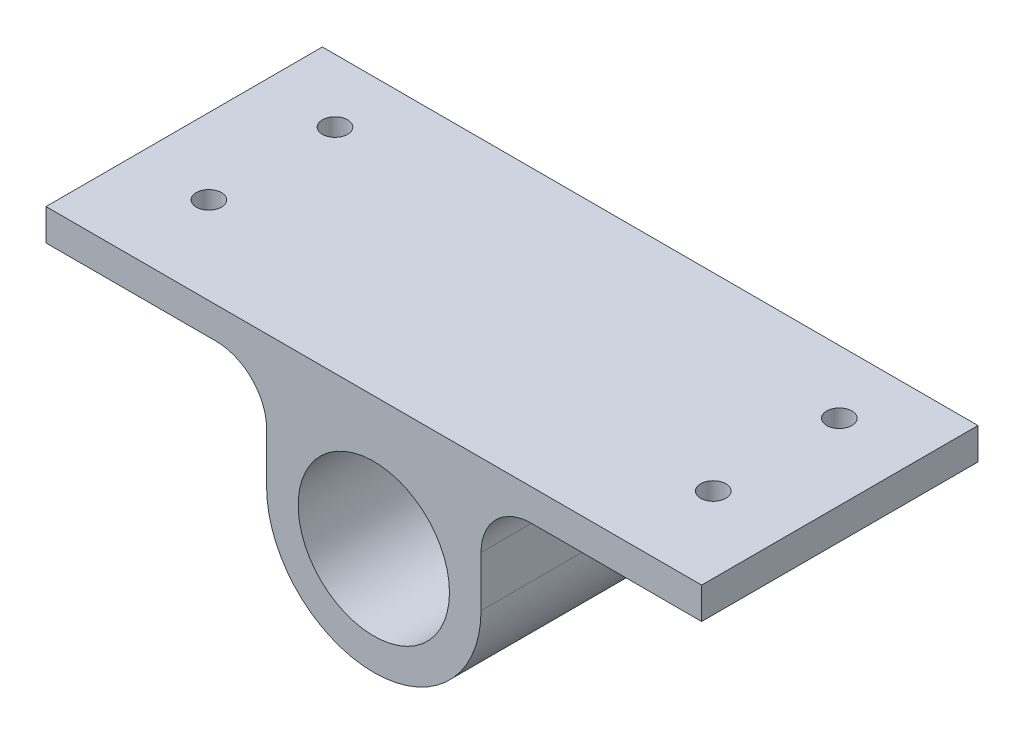
from build123d import *

# Parameters (mm, degrees)
SKETCH1_R           = 19.05
BOSS_EXTRUDE1_DEPTH = 69.596
SKETCH2_R           = 3.175
CUT_EXTRUDE1_DEPTH  = 63.5


with BuildPart() as part:
    # Sketch1 → Boss-Extrude1 (new body)
    with BuildSketch(Plane.XY):
        with BuildLine():
            Line((82.55, 0), (-82.55, 0))
            Line((-82.55, 0), (-82.55, -7.9502))
            Line((-82.55, -7.9502), (-39.7002, -7.9502))
            ThreePointArc((-39.7002, -7.9502), (-30.719943879, -11.669943879), (-27.0002, -20.6502))
            Line((-27.0002, -20.6502), (-27.0002, -33.3502))
            ThreePointArc((-27.0002, -33.3502), (-19.092024562, -52.442224464), (-1.39e-07, -60.3504))
            ThreePointArc((-1.39e-07, -60.3504), (19.092024464, -52.442224562), (27.0002, -33.3502))
            Line((27.0002, -33.3502), (27.0002, -20.6502))
            ThreePointArc((27.0002, -20.6502), (30.719943879, -11.669943879), (39.7002, -7.9502))
            Line((39.7002, -7.9502), (82.55, -7.9502))
            Line((82.55, -7.9502), (82.55, 0))
        make_face()
        with Locations((0, -33.3502)):
            Circle(SKETCH1_R, mode=Mode.SUBTRACT)
    extrude(amount=BOSS_EXTRUDE1_DEPTH)

    # Sketch2 → Cut-Extrude1 (cut)
    with BuildSketch(Plane(origin=(0, 0, 0), x_dir=(1, 0, 0), z_dir=(0, 1, 0))):
        with Locations(Location((63.5, -15.875, 0), (0, 0, 180))):
            Circle(SKETCH2_R)
        with Locations(Location((63.5, -47.625, 0), (0, 0, 180))):
            Circle(SKETCH2_R)
        with Locations(Location((-63.5, -47.625, 0), (0, 0, 270))):
            Circle(SKETCH2_R)
        with Locations(Location((-63.5, -15.875, 0), (0, 0, 270))):
            Circle(SKETCH2_R)
    extrude(amount=-CUT_EXTRUDE1_DEPTH, mode=Mode.SUBTRACT)


solid = part.part
